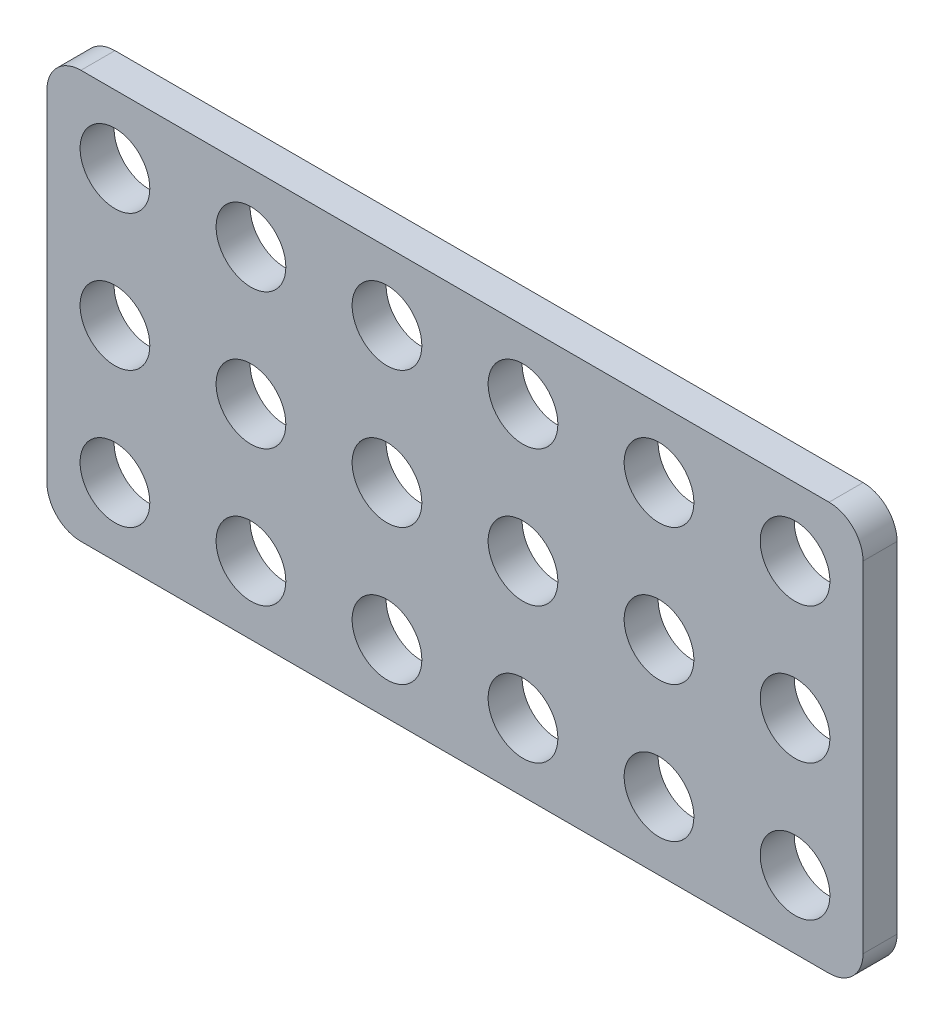
from build123d import *

# Parameters (mm, degrees)
SKETCH1_W            = 48
SKETCH1_H            = 24
BOSS_EXTRUDE1_DEPTH  = 2
SKETCH2_R            = 2.05
CUT_EXTRUDE1_DEPTH   = 54.702886328
LPATTERN1_COUNT      = 6
LPATTERN1_PITCH      = 8
LPATTERN1_COUNT_DIR2 = 3
LPATTERN1_PITCH_DIR2 = 8
FILLET1_R            = 2


with BuildPart() as part:
    # Sketch1 → Boss-Extrude1 (new body)
    with BuildSketch(Plane.XY):
        with Locations((24, 12)):
            Rectangle(SKETCH1_W, SKETCH1_H)
    extrude(amount=BOSS_EXTRUDE1_DEPTH)

    # Sketch2 → Cut-Extrude1 (cut, through all)
    with BuildSketch(Plane.XY.offset(2)):
        with Locations((4, 20)):
            Circle(SKETCH2_R)
    cut_extrude1 = extrude(amount=-CUT_EXTRUDE1_DEPTH, mode=Mode.SUBTRACT)

    # LPattern1: Cut-Extrude1 6 × 3
    with Locations(*[(i * LPATTERN1_PITCH, -j * LPATTERN1_PITCH_DIR2, 0) for i in range(LPATTERN1_COUNT) for j in range(LPATTERN1_COUNT_DIR2) if (i, j) != (0, 0)]):
        add(cut_extrude1, mode=Mode.SUBTRACT)

    # Fillet1
    fillet1_edges = [part.edges().sort_by_distance(p)[0] for p in [
        (0, 24, 1),
        (48, 24, 1),
        (48, 0, 1),
        (0, 0, 1),
    ]]
    fillet(fillet1_edges, radius=FILLET1_R)


solid = part.part
